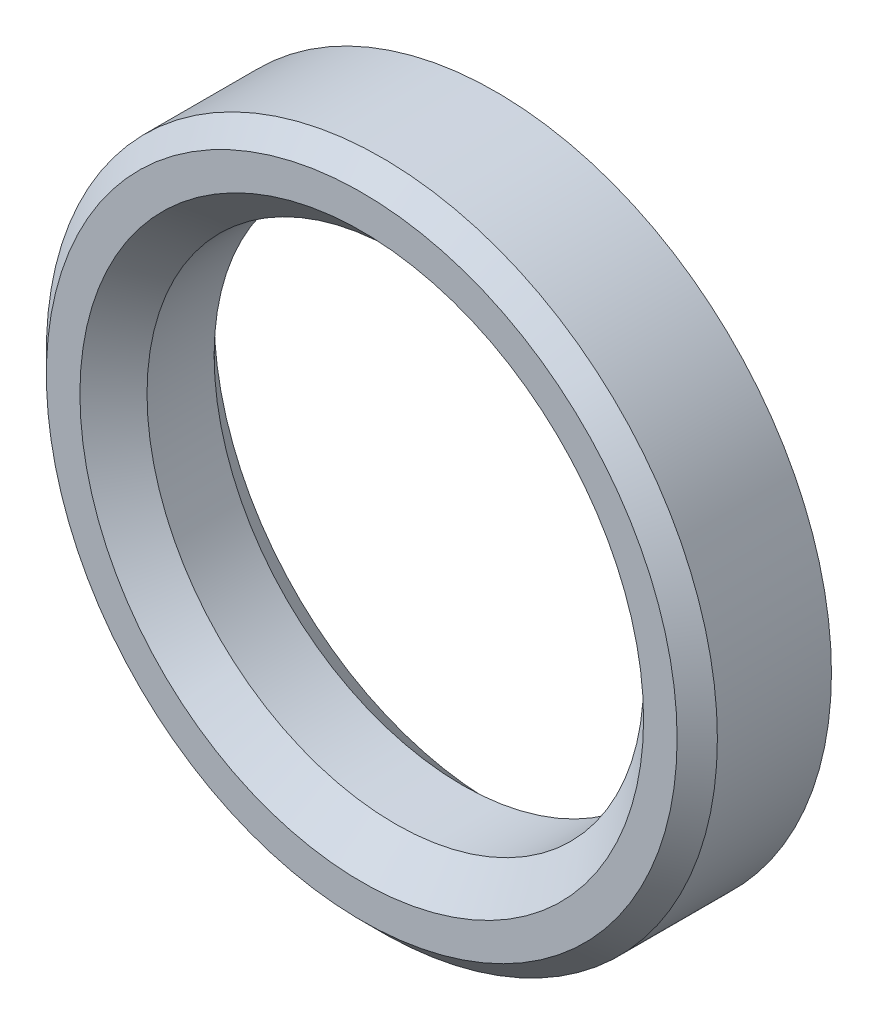
from build123d import *

# Parameters (mm, degrees)
SKETCH1_R           = 5
SKETCH1_R_2         = 3.7
BOSS_EXTRUDE1_DEPTH = 2
CHAMFER1_SIZE       = 0.3
CHAMFER2_SIZE       = 0.5


with BuildPart() as part:
    # Sketch1 → Boss-Extrude1 (new body)
    with BuildSketch(Plane.XY):
        Circle(SKETCH1_R)
        Circle(SKETCH1_R_2, mode=Mode.SUBTRACT)
    extrude(amount=BOSS_EXTRUDE1_DEPTH)

    # Chamfer1
    chamfer1_edges = [part.edges().sort_by_distance(p)[0] for p in [
        (-5, 0, 2),
    ]]
    chamfer(chamfer1_edges, length=CHAMFER1_SIZE)

    # Chamfer2
    chamfer2_edges = [part.edges().sort_by_distance(p)[0] for p in [
        (-3.7, 0, 0),
        (-3.7, 0, 2),
    ]]
    chamfer(chamfer2_edges, length=CHAMFER2_SIZE)


solid = part.part
